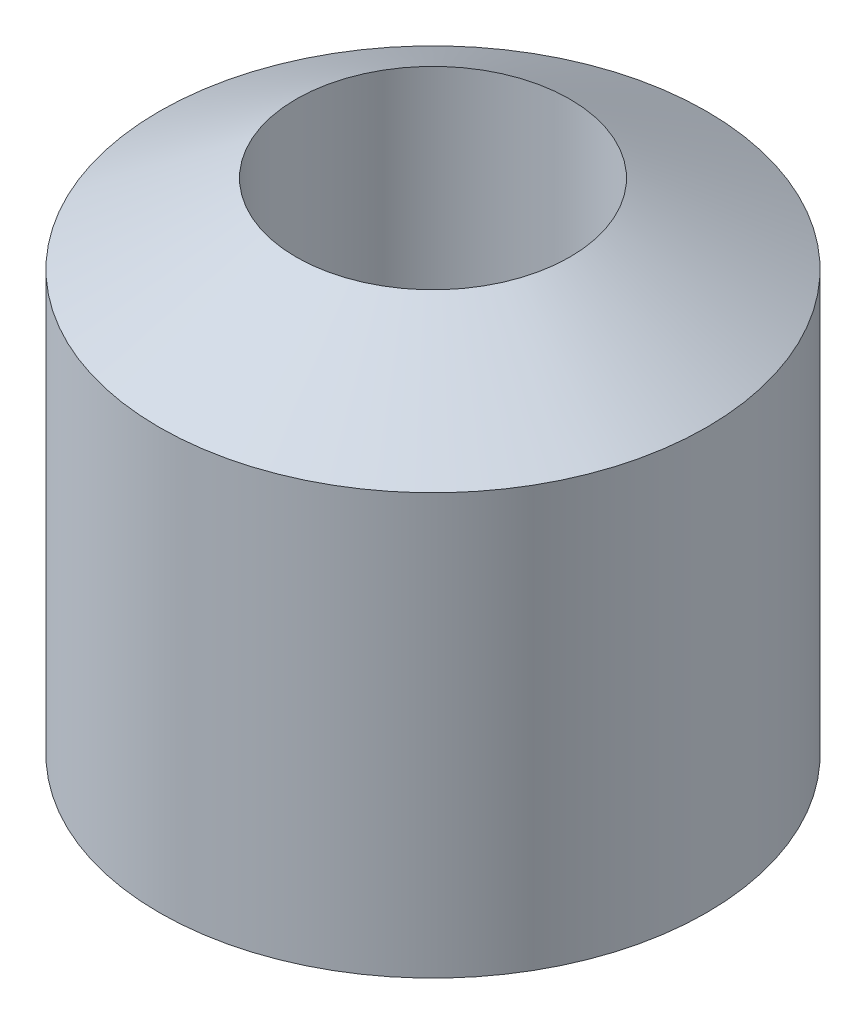
from build123d import *


with BuildPart() as part:
    # Sketch2 → Revolve1 (revolve)
    with BuildSketch(Plane.XY, mode=Mode.PRIVATE) as revolve1_sk:
        Polygon((28, -21.5), (28, 21.5), (14, 29.582903769), (14, -29.582903769), align=None)
    revolve(revolve1_sk.sketch.rotate(Axis((0, 0, 0), (0, 1, 0)), 90), axis=Axis((0, 0, 0), (0, 1, 0)))


solid = part.part
